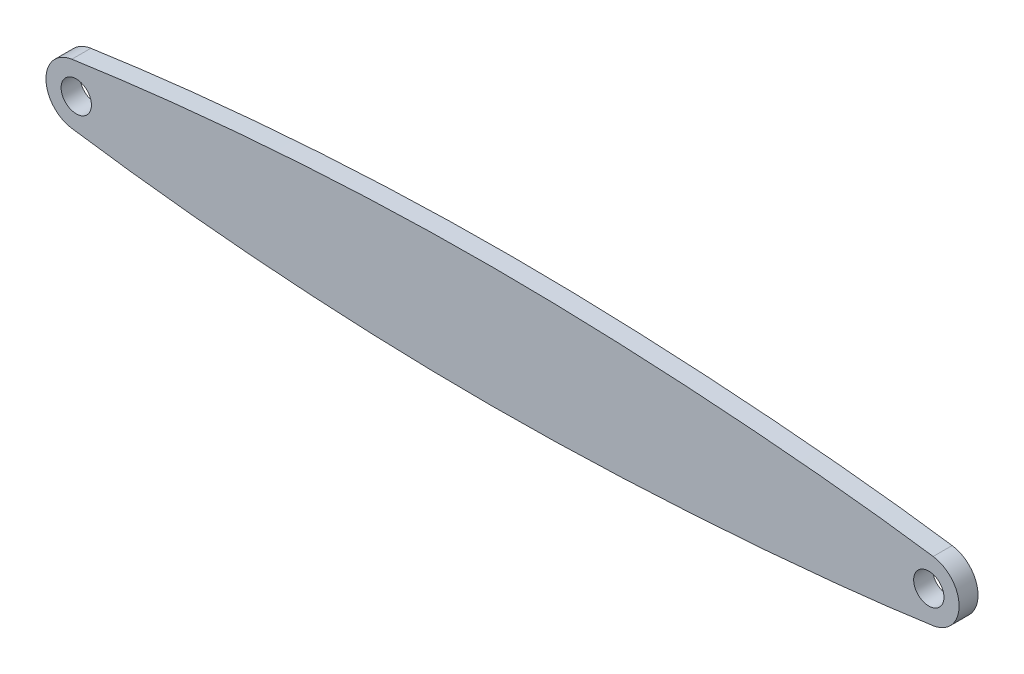
from build123d import *

# Parameters (mm, degrees)
SKETCH_1_R      = 8
EXTRUDE_1_DEPTH = 10


with BuildPart() as part:
    # 草图1 → 凸台-拉伸1 (new body)
    with BuildSketch(Plane.XY):
        with BuildLine():
            ThreePointArc((-2.313590971, 15.831844391), (-16, 0), (-2.313590971, -15.831844391))
            add(Edge.make_bspline(
                [(-2.313590971, -15.831844391), (61.84269778, -25.207341442), (219.572103506, -39.191033108), (399.013095208, -23.620927123), (452.313590971, -15.831844391)],
                knots=[0, 0, 0, 0, 0.5, 1, 1, 1, 1], degree=3))
            ThreePointArc((452.313590971, -15.831844391), (466, 0), (452.313590971, 15.831844391))
            add(Edge.make_bspline(
                [(-2.313590971, 15.831844391), (61.84269778, 25.207341442), (219.572103506, 39.191033108), (399.013095208, 23.620927123), (452.313590971, 15.831844391)],
                knots=[0, 0, 0, 0, 0.5, 1, 1, 1, 1], degree=3))
        make_face()
        Circle(SKETCH_1_R, mode=Mode.SUBTRACT)
        with Locations((450, 0)):
            Circle(SKETCH_1_R, mode=Mode.SUBTRACT)
    extrude(amount=EXTRUDE_1_DEPTH)


solid = part.part
